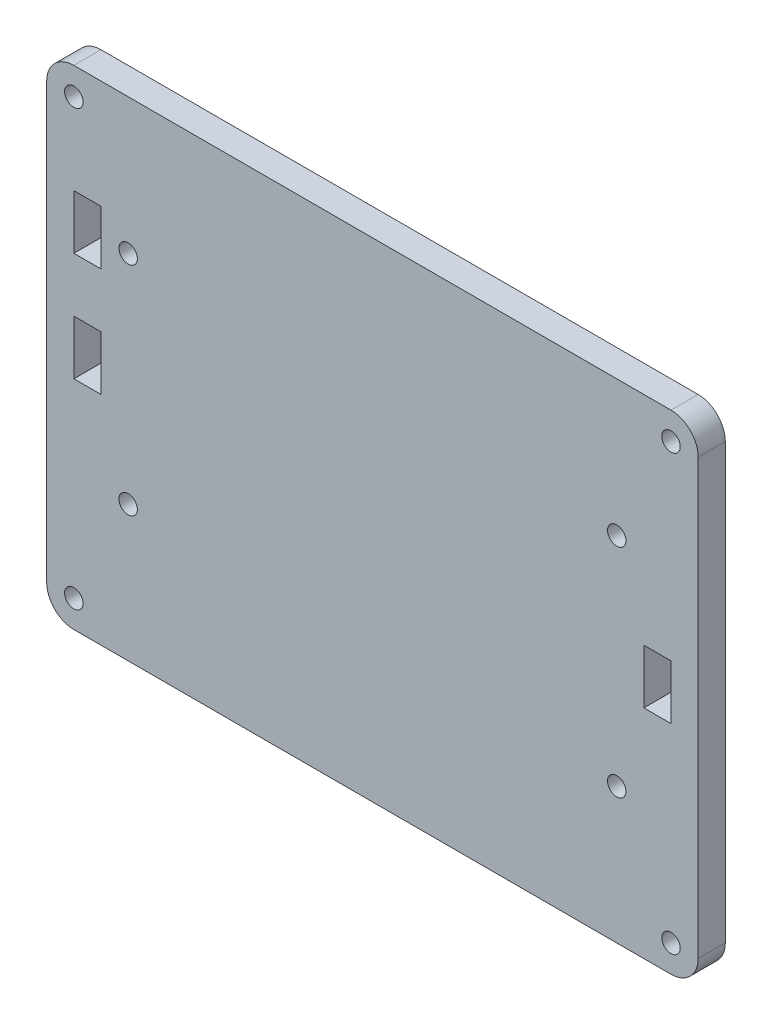
from build123d import *

# Parameters (mm, degrees)
EXTRUDE_1_DEPTH      = 5
SKETCH_1_4_OUTSIDE_W = 152.016
SKETCH_1_4_OUTSIDE_H = 122.016
SKETCH_1_4_OUTSIDE_R = 1.7
CUT_EXTRUDE_3_DEPTH  = 84.683501662
SKETCH_3_W           = 5
SKETCH_3_H           = 10
CUT_EXTRUDE_4_DEPTH  = 10


with BuildPart() as part:
    # 스케치1 → 보스-돌출1 (new body)
    with BuildSketch(Plane.XY):
        with BuildLine():
            Line((-57.749377558, 34.859778143), (52.250622442, 34.859778143))
            ThreePointArc((52.250622442, 34.859778143), (55.786156348, 33.395312049), (57.250622442, 29.859778143))
            Line((57.250622442, 29.859778143), (57.250622442, -50.140221857))
            ThreePointArc((57.250622442, -50.140221857), (55.786156348, -53.675755763), (52.250622442, -55.140221857))
            Line((52.250622442, -55.140221857), (-57.749377558, -55.140221857))
            ThreePointArc((-57.749377558, -55.140221857), (-61.284911464, -53.675755763), (-62.749377558, -50.140221857))
            Line((-62.749377558, -50.140221857), (-62.749377558, 29.859778143))
            ThreePointArc((-62.749377558, 29.859778143), (-61.284911464, 33.395312049), (-57.749377558, 34.859778143))
        make_face()
    extrude(amount=-EXTRUDE_1_DEPTH)

    # 스케치1<4> outside → 컷-돌출3 (cut, through all)
    # profile 1 of 9: a face of its own
    with BuildSketch(Plane.XY):
        with Locations((-2.749, -10.14)):
            Rectangle(SKETCH_1_4_OUTSIDE_W, SKETCH_1_4_OUTSIDE_H)
        with BuildLine():
            Line((-57.749377558, 34.859778143), (52.250622442, 34.859778143))
            ThreePointArc((52.250622442, 34.859778143), (55.786156348, 33.395312049), (57.250622442, 29.859778143))
            Line((57.250622442, 29.859778143), (57.250622442, -50.140221857))
            ThreePointArc((57.250622442, -50.140221857), (55.786156348, -53.675755763), (52.250622442, -55.140221857))
            Line((52.250622442, -55.140221857), (-57.749377558, -55.140221857))
            ThreePointArc((-57.749377558, -55.140221857), (-61.284911464, -53.675755763), (-62.749377558, -50.140221857))
            Line((-62.749377558, -50.140221857), (-62.749377558, 29.859778143))
            ThreePointArc((-62.749377558, 29.859778143), (-61.284911464, 33.395312049), (-57.749377558, 34.859778143))
        make_face(mode=Mode.SUBTRACT)
    # profile 2 of 9: a face of its own
    with BuildSketch(Plane.XY):
        with Locations((-57.749377558, 29.859778143)):
            Circle(SKETCH_1_4_OUTSIDE_R)
    # profile 3 of 9: a face of its own
    with BuildSketch(Plane.XY):
        with Locations((52.250622442, 29.859778143)):
            Circle(SKETCH_1_4_OUTSIDE_R)
    # profile 4 of 9: a face of its own
    with BuildSketch(Plane.XY):
        with Locations((-57.749377558, -50.140221857)):
            Circle(SKETCH_1_4_OUTSIDE_R)
    # profile 5 of 9: a face of its own
    with BuildSketch(Plane.XY):
        with Locations((52.250622442, -50.140221857)):
            Circle(SKETCH_1_4_OUTSIDE_R)
    # profile 6 of 9: a face of its own
    with BuildSketch(Plane.XY):
        with Locations((-47.749377558, 9.859778143)):
            Circle(SKETCH_1_4_OUTSIDE_R)
    # profile 7 of 9: a face of its own
    with BuildSketch(Plane.XY):
        with Locations((-47.749377558, -30.140221857)):
            Circle(SKETCH_1_4_OUTSIDE_R)
    # profile 8 of 9: a face of its own
    with BuildSketch(Plane.XY):
        with Locations((42.250622442, 9.859778143)):
            Circle(SKETCH_1_4_OUTSIDE_R)
    # profile 9 of 9: a face of its own
    with BuildSketch(Plane.XY):
        with Locations((42.250622442, -30.140221857)):
            Circle(SKETCH_1_4_OUTSIDE_R)
    extrude(amount=-CUT_EXTRUDE_3_DEPTH, mode=Mode.SUBTRACT)

    # 스케치3 → 컷-돌출4 (cut)
    with BuildSketch(Plane.XY):
        with Locations((-55.249377558, -10.140221857)):
            Rectangle(SKETCH_3_W, SKETCH_3_H)
        with Locations((49.750622442, -10.140221857)):
            Rectangle(SKETCH_3_W, SKETCH_3_H)
        with Locations((-55.249377558, 9.881604628)):
            Rectangle(SKETCH_3_W, SKETCH_3_H)
    extrude(amount=-CUT_EXTRUDE_4_DEPTH, mode=Mode.SUBTRACT)


solid = part.part
